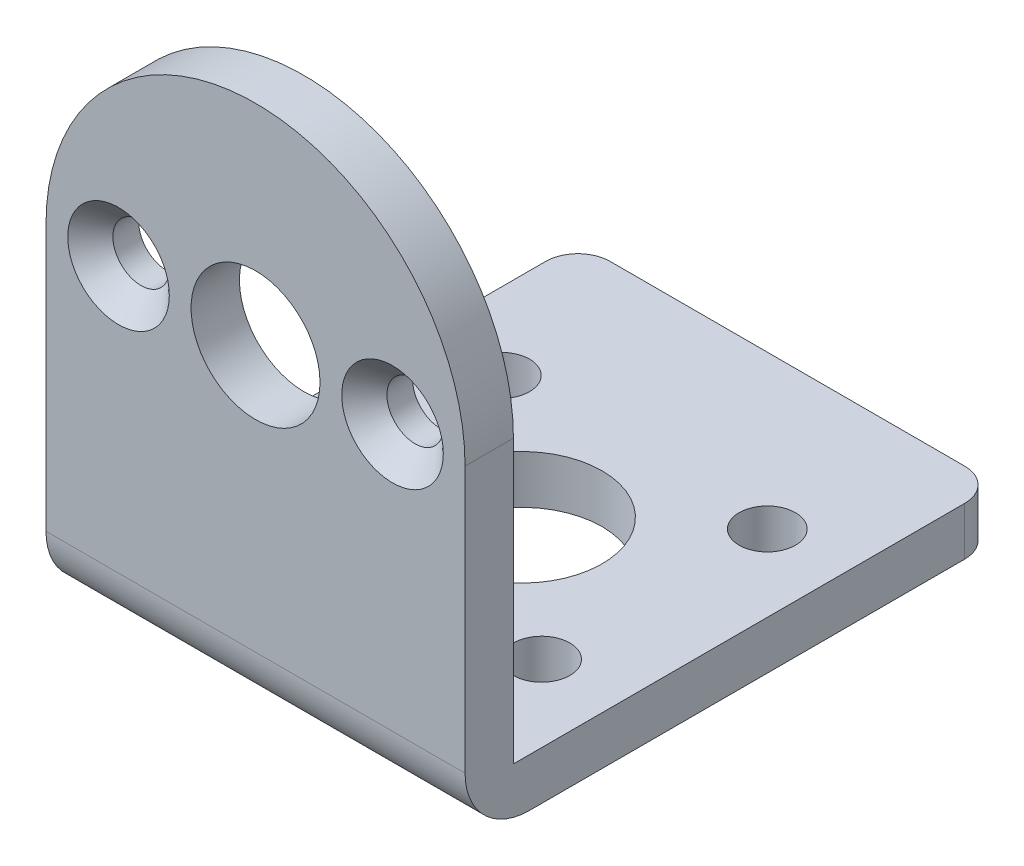
from build123d import *

# Parameters (mm, degrees)
SKETCH_2_R                   = 44.45
SKETCH_2_R_2                 = 127
EXTRUDE_1_DEPTH              = 76.2
SKETCH_4_W                   = 660.4
SKETCH_4_H                   = 76.2
EXTRUDE_2_DEPTH              = 850.9
FILLET_2_R                   = 101.6
SKETCH_5_R                   = 44.45
SKETCH_5_R_2                 = 101.6
CUT_EXTRUDE_1_DEPTH          = 850.9
SCALE_1_SCALE                = 0.039370079
HOLE_WIZARD_M6_3_D           = 3.5
HOLE_WIZARD_M6_3_DEPTH       = 16.51
HOLE_WIZARD_M6_3_CSINK_D     = 6.3
HOLE_WIZARD_M6_3_CSINK_ANGLE = 90
HOLE_WIZARD_M6_3_TIP         = 1.051506083


with BuildPart() as part:
    # 草图2 → 凸台-拉伸1 (new body)
    with BuildSketch(Plane(origin=(0, 0, 0), x_dir=(1, 0, 0), z_dir=(0, 1, 0))):
        with BuildLine():
            Line((-330.2, 368.3), (-330.2, -342.9))
            Line((-330.2, -342.9), (330.2, -342.9))
            Line((330.2, -342.9), (330.2, 368.3))
            ThreePointArc((330.2, 368.3), (315.321024484, 404.221024484), (279.4, 419.1))
            Line((279.4, 419.1), (-279.4, 419.1))
            ThreePointArc((-279.4, 419.1), (-315.321024484, 404.221024484), (-330.2, 368.3))
        make_face()
        with Locations(Location((-209.55, -177.8, 0), (0, 0, 90))):
            Circle(SKETCH_2_R, mode=Mode.SUBTRACT)
        with Locations(Location((0, 0, 0), (0, 0, 90))):
            Circle(SKETCH_2_R_2, mode=Mode.SUBTRACT)
        with Locations(Location((209.55, -177.8, 0), (0, 0, 90))):
            Circle(SKETCH_2_R, mode=Mode.SUBTRACT)
        with Locations(Location((-209.55, 177.8, 0), (0, 0, 90))):
            Circle(SKETCH_2_R, mode=Mode.SUBTRACT)
        with Locations(Location((209.55, 177.8, 0), (0, 0, 90))):
            Circle(SKETCH_2_R, mode=Mode.SUBTRACT)
    extrude(amount=EXTRUDE_1_DEPTH)

    # 草图4 → 凸台-拉伸2 (add)
    with BuildSketch(Plane(origin=(0, 0, 0), x_dir=(1, 0, 0), z_dir=(0, 1, 0))):
        with Locations((0, -381)):
            Rectangle(SKETCH_4_W, SKETCH_4_H)
    extrude(amount=EXTRUDE_2_DEPTH)

    # 圆角2
    fillet_2_edges = [part.edges().sort_by_distance(p)[0] for p in [
        (0, 0, 419.1),
    ]]
    fillet(fillet_2_edges, radius=FILLET_2_R)

    # 草图5 → 切除-拉伸1 (cut)
    with BuildSketch(Plane.XY.offset(419.1)):
        with BuildLine():
            ThreePointArc((-330.2, 520.7), (-233.486660985, 754.186657311), (-5.196e-06, 850.9))
            Line((-5.196e-06, 850.9), (-330.2, 850.9))
            Line((-330.2, 850.9), (-330.2, 520.7))
        make_face()
        with BuildLine():
            Line((330.2, 520.7), (330.2, 850.9))
            Line((330.2, 850.9), (-5.196e-06, 850.9))
            ThreePointArc((-5.196e-06, 850.9), (233.486657311, 754.186660985), (330.2, 520.7))
        make_face()
        with Locations((215.9, 520.7)):
            Circle(SKETCH_5_R)
        with Locations((-215.9, 520.7)):
            Circle(SKETCH_5_R)
        with Locations((0, 520.7)):
            Circle(SKETCH_5_R_2)
    extrude(amount=-CUT_EXTRUDE_1_DEPTH, mode=Mode.SUBTRACT)


with BuildPart() as part_1:
    # 缩放比例1: scaled about (0, 222.368151505, 174.146040327)
    add(part.part.scale(SCALE_1_SCALE).moved(Location((0, 213.613499871, 167.289897007))))

    # M6 内六角花形半沉头螺钉的锥形沉头孔3
    with Locations(Plane.XY.offset(183.789897007)):
        with Locations((-8.5, 234.113499871), (8.5, 234.113499871)):
            CounterSinkHole(HOLE_WIZARD_M6_3_D / 2, HOLE_WIZARD_M6_3_CSINK_D / 2, depth=HOLE_WIZARD_M6_3_DEPTH, counter_sink_angle=HOLE_WIZARD_M6_3_CSINK_ANGLE)
            with Locations((0, 0, -(HOLE_WIZARD_M6_3_DEPTH + HOLE_WIZARD_M6_3_TIP / 2))):  # 118° drill point
                Cone(0, HOLE_WIZARD_M6_3_D / 2, HOLE_WIZARD_M6_3_TIP, mode=Mode.SUBTRACT)


solid = part_1.part
